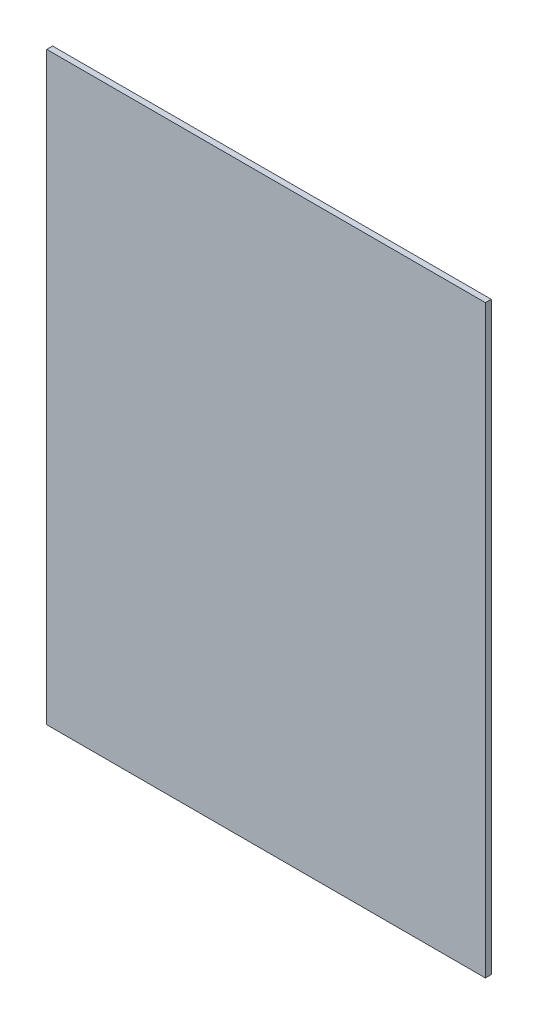
from build123d import *

# Parameters (mm, degrees)
SKIZZE1_W                       = 200
SKIZZE1_H                       = 150
AUFSATZ_LINEAR_AUSTRAGEN1_DEPTH = 2


with BuildPart() as part:
    # Skizze1 → Aufsatz-Linear austragen1 (new body)
    with BuildSketch(Plane(origin=(0, 0, 0), x_dir=(0, 1, 0), z_dir=(0, 0, 1))):
        Rectangle(SKIZZE1_W, SKIZZE1_H)
    extrude(amount=AUFSATZ_LINEAR_AUSTRAGEN1_DEPTH)


solid = part.part
